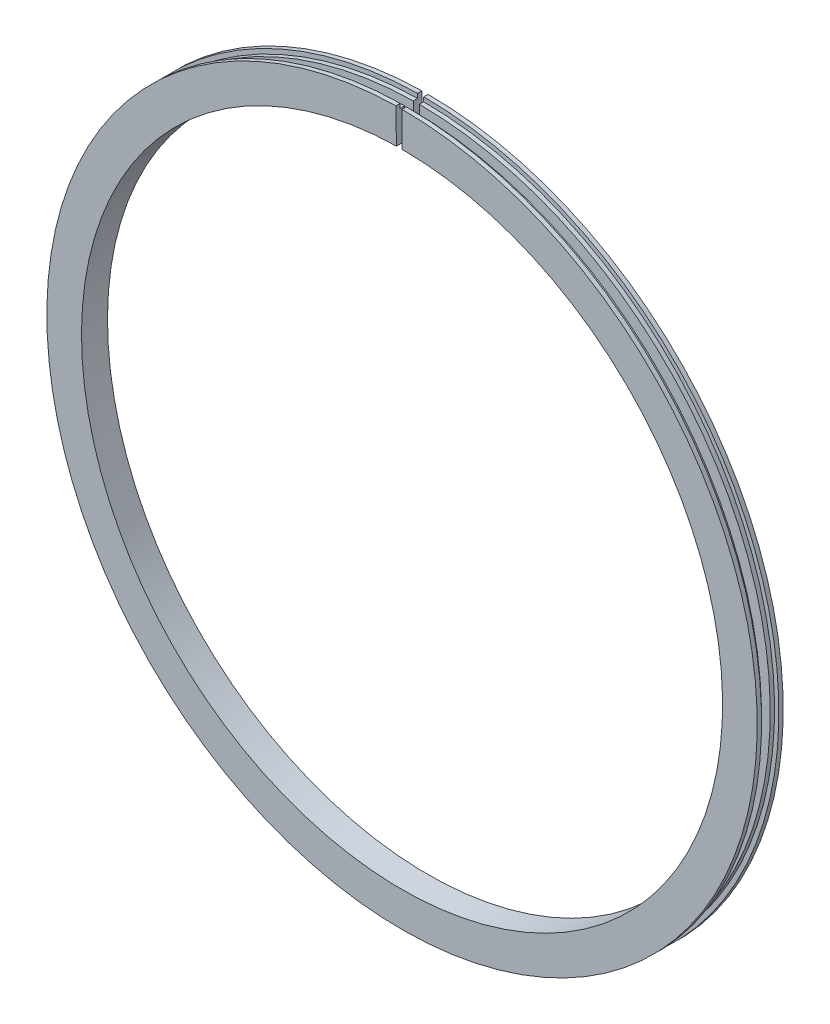
from build123d import *

# Parameters (mm, degrees)
REVOLVE_1_ANGLE = 359


with BuildPart() as part:
    # 草图2 → 旋转1 (revolve)
    with BuildSketch(Plane(origin=(0, 0, 0), x_dir=(0, 1, 0), z_dir=(-1, 0, 0))):
        Polygon((37, 0), (41, 0), (41, 0.5), (40.5, 0.5), (40.5, 1), (38.5, 1), (38.5, 2), (40.5, 2), (40.5, 2.5), (41, 2.5), (41, 3), (37, 3), align=None)
    revolve(axis=Axis((0, 0, 0), (0, 0, -1)), revolution_arc=REVOLVE_1_ANGLE)


solid = part.part
